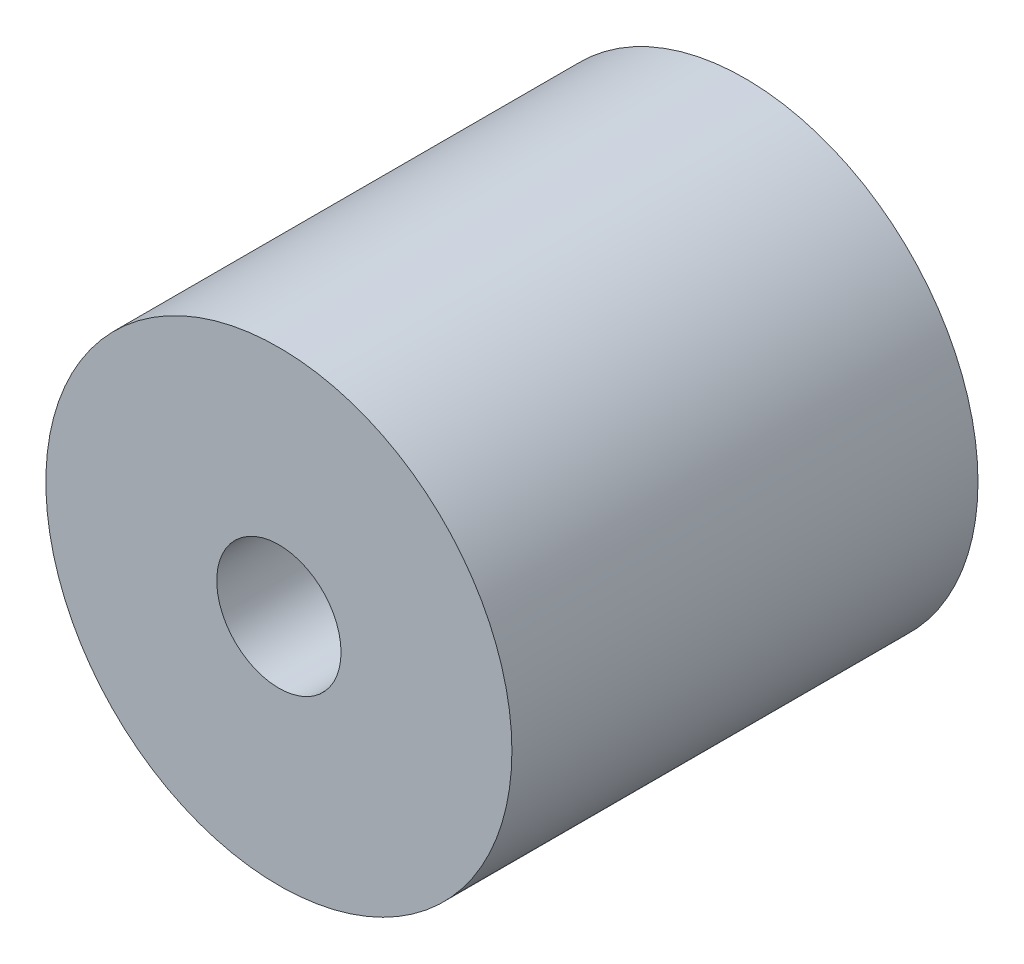
from build123d import *

# Parameters (mm, degrees)
SKETCH1_R          = 15
EXTRUDE1_DEPTH     = 15
SKETCH2_R          = 4
CUT_EXTRUDE1_DEPTH = 15


with BuildPart() as part:
    # Sketch1 → Extrude1 (new, symmetric)
    with BuildSketch(Plane.XY):
        Circle(SKETCH1_R)
    extrude(amount=EXTRUDE1_DEPTH, both=True)

    # Sketch2 → Cut-Extrude1 (cut, symmetric)
    with BuildSketch(Plane.XY):
        Circle(SKETCH2_R)
    extrude(amount=CUT_EXTRUDE1_DEPTH, both=True, mode=Mode.SUBTRACT)


solid = part.part
